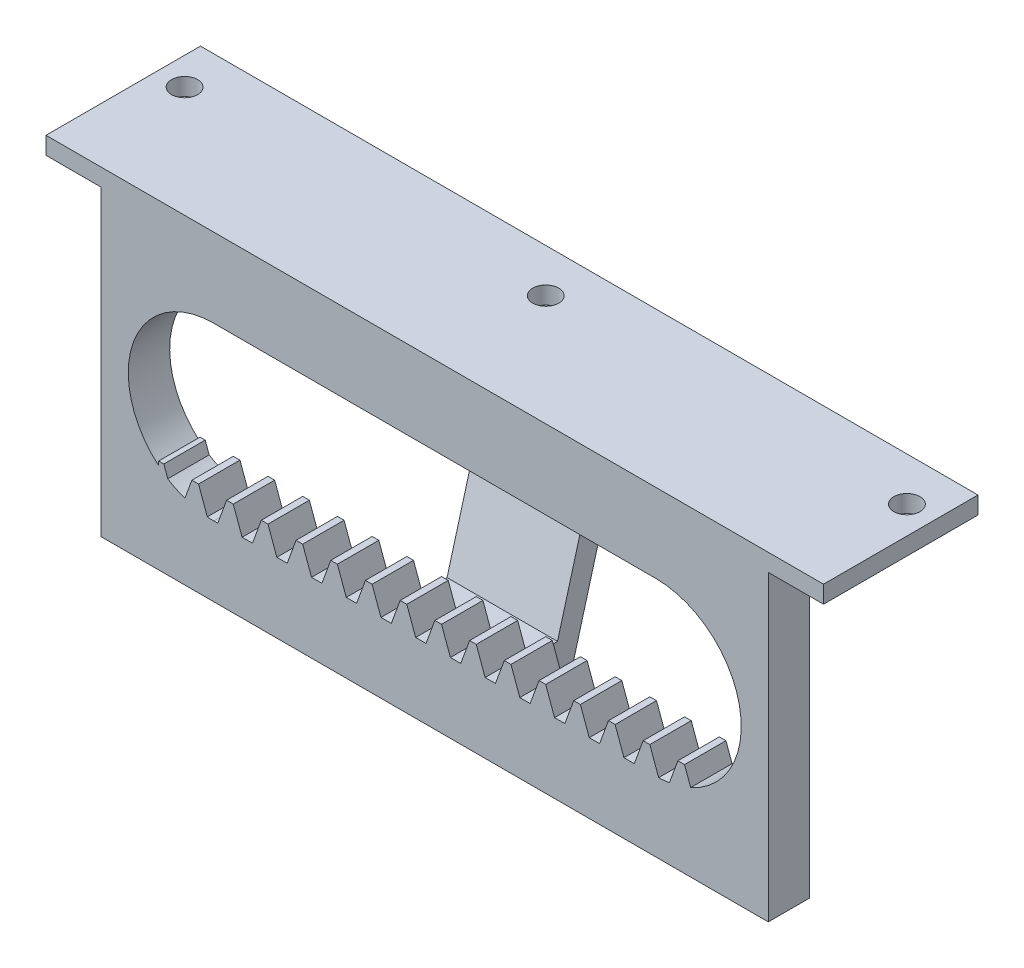
from build123d import *

# Parameters (mm, degrees)
SKETCH1_W           = 63.5
SKETCH1_H           = 4.7625
BOSS_EXTRUDE1_DEPTH = 4.5
CUT_EXTRUDE1_DEPTH  = 64.837147542
SKETCH4_W           = 76.708
SKETCH4_H           = 36.80996
BOSS_EXTRUDE2_DEPTH = 4.7625
SKETCH6_W           = 6.35
SKETCH6_H           = 17.76349
SKETCH6_R           = 1.5
BOSS_EXTRUDE3_DEPTH = 2
BOSS_EXTRUDE4_DEPTH = 25.4
BOSS_EXTRUDE5_DEPTH = 33.3375
SKETCH8_W           = 19.05
SKETCH8_H           = 13.00099
CUT_EXTRUDE2_DEPTH  = 86.863199382
SKETCH9_R           = 1.5
CUT_EXTRUDE3_DEPTH  = 86.863199382
FILLET1_R           = 2.54
SKETCH10_W          = 13.00099
SKETCH10_H          = 2
BOSS_EXTRUDE6_DEPTH = 5.0165
SKETCH11_W          = 13.00099
SKETCH11_H          = 2
BOSS_EXTRUDE7_DEPTH = 5.0165


with BuildPart() as part:
    # Sketch1 → Boss-Extrude1 (new body)
    with BuildSketch(Plane(origin=(0, 0, 0), x_dir=(1, 0, 0), z_dir=(0, 1, 0))):
        with Locations((31.75, 2.38125)):
            Rectangle(SKETCH1_W, SKETCH1_H)
    extrude(amount=BOSS_EXTRUDE1_DEPTH)

    # Sketch2 → Cut-Extrude1 (cut, through all)
    with BuildSketch(Plane.XY):
        Polygon((0.595167363, 4.5), (1.613024682, 1.70346), (2.208192045, 1.70346), (2.803359408, 1.70346), (3.821216727, 4.5), align=None)
        Polygon((4.586843593, 4.5), (5.604700912, 1.70346), (6.199868275, 1.70346), (6.795035638, 1.70346), (7.812892957, 4.5), align=None)
        Polygon((8.578519823, 4.5), (9.596377142, 1.70346), (10.191544505, 1.70346), (10.786711868, 1.70346), (11.804569186, 4.5), align=None)
        Polygon((12.570196052, 4.5), (13.588053371, 1.70346), (14.183220734, 1.70346), (14.778388097, 1.70346), (15.796245416, 4.5), align=None)
        Polygon((16.561872282, 4.5), (17.579729601, 1.70346), (18.174896964, 1.70346), (18.770064327, 1.70346), (19.787921646, 4.5), align=None)
        Polygon((20.553548512, 4.5), (21.571405831, 1.70346), (22.166573194, 1.70346), (22.761740557, 1.70346), (23.779597876, 4.5), align=None)
        Polygon((24.545224742, 4.5), (25.563082061, 1.70346), (26.158249424, 1.70346), (26.753416787, 1.70346), (27.771274106, 4.5), align=None)
        Polygon((28.536900972, 4.5), (29.554758291, 1.70346), (30.149925654, 1.70346), (30.745093017, 1.70346), (31.762950336, 4.5), align=None)
        Polygon((32.528577202, 4.5), (33.546434521, 1.70346), (34.141601884, 1.70346), (34.736769246, 1.70346), (35.754626565, 4.5), align=None)
        Polygon((36.520253431, 4.5), (37.53811075, 1.70346), (38.133278113, 1.70346), (38.728445476, 1.70346), (39.746302795, 4.5), align=None)
        Polygon((40.511929661, 4.5), (41.52978698, 1.70346), (42.124954343, 1.70346), (42.720121706, 1.70346), (43.737979025, 4.5), align=None)
        Polygon((44.503605891, 4.5), (45.52146321, 1.70346), (46.116630573, 1.70346), (46.711797936, 1.70346), (47.729655255, 4.5), align=None)
        Polygon((48.495282121, 4.5), (49.51313944, 1.70346), (50.108306803, 1.70346), (50.703474166, 1.70346), (51.721331485, 4.5), align=None)
        Polygon((52.486958351, 4.5), (53.50481567, 1.70346), (54.099983033, 1.70346), (54.695150396, 1.70346), (55.713007715, 4.5), align=None)
        Polygon((56.478634581, 4.5), (57.496491899, 1.70346), (58.091659262, 1.70346), (58.686826625, 1.70346), (59.704683944, 4.5), align=None)
        Polygon((60.47031081, 4.5), (61.488168129, 1.70346), (62.083335492, 1.70346), (62.678502855, 1.70346), (63.696360174, 4.5), align=None)
        Polygon((64.46198704, 4.5), (65.479844359, 1.70346), (66.075011722, 1.70346), (66.670179085, 1.70346), (67.688036404, 4.5), align=None)
        Polygon((68.45366327, 4.5), (69.471520589, 1.70346), (70.066687952, 1.70346), (70.661855315, 1.70346), (71.679712634, 4.5), align=None)
        Polygon((72.4453395, 4.5), (73.463196819, 1.70346), (74.058364182, 1.70346), (74.653531545, 1.70346), (75.671388864, 4.5), align=None)
        Polygon((76.43701573, 4.5), (77.454873049, 1.70346), (78.050040412, 1.70346), (78.645207775, 1.70346), (79.663065094, 4.5), align=None)
        Polygon((80.42869196, 4.5), (81.446549278, 1.70346), (82.041716641, 1.70346), (82.636884004, 1.70346), (83.654741323, 4.5), align=None)
        Polygon((84.420368189, 4.5), (85.438225508, 1.70346), (86.033392871, 1.70346), (86.628560234, 1.70346), (87.646417553, 4.5), align=None)
        Polygon((88.412044419, 4.5), (89.429901738, 1.70346), (90.025069101, 1.70346), (90.620236464, 1.70346), (91.638093783, 4.5), align=None)
        Polygon((92.403720649, 4.5), (93.421577968, 1.70346), (94.016745331, 1.70346), (94.611912694, 1.70346), (95.629770013, 4.5), align=None)
        Polygon((96.395396879, 4.5), (97.413254198, 1.70346), (98.008421561, 1.70346), (98.603588924, 1.70346), (99.621446243, 4.5), align=None)
        Polygon((100.387073109, 4.5), (101.404930428, 1.70346), (102.000097791, 1.70346), (102.595265154, 1.70346), (103.613122472, 4.5), align=None)
        Polygon((104.378749338, 4.5), (105.396606657, 1.70346), (105.99177402, 1.70346), (106.586941383, 1.70346), (107.604798702, 4.5), align=None)
        Polygon((108.370425568, 4.5), (109.388282887, 1.70346), (109.98345025, 1.70346), (110.578617613, 1.70346), (111.596474932, 4.5), align=None)
        Polygon((112.362101798, 4.5), (113.379959117, 1.70346), (113.97512648, 1.70346), (114.570293843, 1.70346), (115.588151162, 4.5), align=None)
        Polygon((116.353778028, 4.5), (117.371635347, 1.70346), (117.96680271, 1.70346), (118.561970073, 1.70346), (119.579827392, 4.5), align=None)
        Polygon((120.345454258, 4.5), (121.363311577, 1.70346), (121.95847894, 1.70346), (122.553646303, 1.70346), (123.571503622, 4.5), align=None)
        Polygon((124.337130488, 4.5), (125.354987807, 1.70346), (125.95015517, 1.70346), (126.545322532, 1.70346), (127.563179851, 4.5), align=None)
        Polygon((128.328806717, 4.5), (129.346664036, 1.70346), (129.941831399, 1.70346), (130.536998762, 1.70346), (131.554856081, 4.5), align=None)
        Polygon((132.320482947, 4.5), (133.338340266, 1.70346), (133.933507629, 1.70346), (134.528674992, 1.70346), (135.546532311, 4.5), align=None)
        Polygon((136.312159177, 4.5), (137.330016496, 1.70346), (137.925183859, 1.70346), (138.520351222, 1.70346), (139.538208541, 4.5), align=None)
        Polygon((140.303835407, 4.5), (141.321692726, 1.70346), (141.916860089, 1.70346), (142.512027452, 1.70346), (143.529884771, 4.5), align=None)
        Polygon((144.295511637, 4.5), (145.313368956, 1.70346), (145.908536319, 1.70346), (146.503703682, 1.70346), (147.521561001, 4.5), align=None)
        Polygon((148.287187867, 4.5), (149.305045185, 1.70346), (149.900212548, 1.70346), (150.495379911, 1.70346), (151.51323723, 4.5), align=None)
        Polygon((152.278864096, 4.5), (153.296721415, 1.70346), (153.891888778, 1.70346), (154.487056141, 1.70346), (155.50491346, 4.5), align=None)
        Polygon((156.270540326, 4.5), (157.288397645, 1.70346), (157.883565008, 1.70346), (158.478732371, 1.70346), (159.49658969, 4.5), align=None)
        Polygon((160.262216556, 4.5), (161.280073875, 1.70346), (161.875241238, 1.70346), (162.470408601, 1.70346), (163.48826592, 4.5), align=None)
        Polygon((164.253892786, 4.5), (165.271750105, 1.70346), (165.866917468, 1.70346), (166.462084831, 1.70346), (167.47994215, 4.5), align=None)
        Polygon((168.245569016, 4.5), (169.263426335, 1.70346), (169.858593698, 1.70346), (170.453761061, 1.70346), (171.47161838, 4.5), align=None)
        Polygon((172.237245246, 4.5), (173.255102564, 1.70346), (173.850269927, 1.70346), (174.44543729, 1.70346), (175.463294609, 4.5), align=None)
        Polygon((176.228921475, 4.5), (177.246778794, 1.70346), (177.841946157, 1.70346), (178.43711352, 1.70346), (179.454970839, 4.5), align=None)
        Polygon((180.220597705, 4.5), (181.238455024, 1.70346), (181.833622387, 1.70346), (182.42878975, 1.70346), (183.446647069, 4.5), align=None)
        Polygon((184.212273935, 4.5), (185.230131254, 1.70346), (185.825298617, 1.70346), (186.42046598, 1.70346), (187.438323299, 4.5), align=None)
        Polygon((188.203950165, 4.5), (189.221807484, 1.70346), (189.816974847, 1.70346), (190.41214221, 1.70346), (191.429999529, 4.5), align=None)
        Polygon((192.195626395, 4.5), (193.213483714, 1.70346), (193.808651077, 1.70346), (194.40381844, 1.70346), (195.421675758, 4.5), align=None)
        Polygon((196.187302624, 4.5), (197.205159943, 1.70346), (197.800327306, 1.70346), (198.395494669, 1.70346), (199.413351988, 4.5), align=None)
        Polygon((200.178978854, 4.5), (201.196836173, 1.70346), (201.792003536, 1.70346), (202.387170899, 1.70346), (203.405028218, 4.5), align=None)
        Polygon((204.170655084, 4.5), (205.188512403, 1.70346), (205.783679766, 1.70346), (206.378847129, 1.70346), (207.396704448, 4.5), align=None)
        Polygon((208.162331314, 4.5), (209.180188633, 1.70346), (209.775355996, 1.70346), (210.370523359, 1.70346), (211.388380678, 4.5), align=None)
        Polygon((212.154007544, 4.5), (213.171864863, 1.70346), (213.767032226, 1.70346), (214.362199589, 1.70346), (215.380056908, 4.5), align=None)
        Polygon((216.145683774, 4.5), (217.163541093, 1.70346), (217.758708456, 1.70346), (218.353875818, 1.70346), (219.371733137, 4.5), align=None)
        Polygon((220.137360003, 4.5), (221.155217322, 1.70346), (221.750384685, 1.70346), (222.345552048, 1.70346), (223.363409367, 4.5), align=None)
        Polygon((224.129036233, 4.5), (225.146893552, 1.70346), (225.742060915, 1.70346), (226.337228278, 1.70346), (227.355085597, 4.5), align=None)
        Polygon((228.120712463, 4.5), (229.138569782, 1.70346), (229.733737145, 1.70346), (230.328904508, 1.70346), (231.346761827, 4.5), align=None)
        Polygon((232.112388693, 4.5), (233.130246012, 1.70346), (233.725413375, 1.70346), (234.320580738, 1.70346), (235.338438057, 4.5), align=None)
        Polygon((236.104064923, 4.5), (237.121922242, 1.70346), (237.717089605, 1.70346), (238.312256968, 1.70346), (239.330114287, 4.5), align=None)
        Polygon((240.095741153, 4.5), (241.113598471, 1.70346), (241.708765834, 1.70346), (242.303933197, 1.70346), (243.321790516, 4.5), align=None)
        Polygon((244.087417382, 4.5), (245.105274701, 1.70346), (245.700442064, 1.70346), (246.295609427, 1.70346), (247.313466746, 4.5), align=None)
        Polygon((248.079093612, 4.5), (249.096950931, 1.70346), (249.692118294, 1.70346), (250.287285657, 1.70346), (251.305142976, 4.5), align=None)
        Polygon((252.070769842, 4.5), (253.088627161, 1.70346), (253.683794524, 1.70346), (254.278961887, 1.70346), (255.296819206, 4.5), align=None)
        Polygon((256.062446072, 4.5), (257.080303391, 1.70346), (257.675470754, 1.70346), (258.270638117, 1.70346), (259.288495436, 4.5), align=None)
        Polygon((260.054122302, 4.5), (261.071979621, 1.70346), (261.667146984, 1.70346), (262.262314347, 1.70346), (263.280171666, 4.5), align=None)
        Polygon((264.045798532, 4.5), (265.06365585, 1.70346), (265.658823213, 1.70346), (266.253990576, 1.70346), (267.271847895, 4.5), align=None)
        Polygon((268.037474761, 4.5), (269.05533208, 1.70346), (269.650499443, 1.70346), (270.245666806, 1.70346), (271.263524125, 4.5), align=None)
        Polygon((272.029150991, 4.5), (273.04700831, 1.70346), (273.642175673, 1.70346), (274.237343036, 1.70346), (275.255200355, 4.5), align=None)
        Polygon((276.020827221, 4.5), (277.03868454, 1.70346), (277.633851903, 1.70346), (278.229019266, 1.70346), (279.246876585, 4.5), align=None)
        Polygon((280.012503451, 4.5), (281.03036077, 1.70346), (281.625528133, 1.70346), (282.220695496, 1.70346), (283.238552815, 4.5), align=None)
        Polygon((284.004179681, 4.5), (285.022037, 1.70346), (285.617204363, 1.70346), (286.212371726, 1.70346), (287.230229044, 4.5), align=None)
        Polygon((287.99585591, 4.5), (289.013713229, 1.70346), (289.608880592, 1.70346), (290.204047955, 1.70346), (291.221905274, 4.5), align=None)
        Polygon((291.98753214, 4.5), (293.005389459, 1.70346), (293.600556822, 1.70346), (294.195724185, 1.70346), (295.213581504, 4.5), align=None)
        Polygon((295.97920837, 4.5), (296.997065689, 1.70346), (297.592233052, 1.70346), (298.187400415, 1.70346), (299.205257734, 4.5), align=None)
        Polygon((299.9708846, 4.5), (300.988741919, 1.70346), (301.583909282, 1.70346), (302.179076645, 1.70346), (303.196933964, 4.5), align=None)
        Polygon((303.96256083, 4.5), (304.980418149, 1.70346), (305.575585512, 1.70346), (306.170752875, 1.70346), (307.188610194, 4.5), align=None)
        Polygon((307.95423706, 4.5), (308.972094379, 1.70346), (309.567261742, 1.70346), (310.162429104, 1.70346), (311.180286423, 4.5), align=None)
        Polygon((311.945913289, 4.5), (312.963770608, 1.70346), (313.558937971, 1.70346), (314.154105334, 1.70346), (315.171962653, 4.5), align=None)
        Polygon((315.937589519, 4.5), (316.955446838, 1.70346), (317.550614201, 1.70346), (318.145781564, 1.70346), (319.163638883, 4.5), align=None)
        Polygon((319.929265749, 4.5), (320.947123068, 1.70346), (321.542290431, 1.70346), (322.137457794, 1.70346), (323.155315113, 4.5), align=None)
        Polygon((323.920941979, 4.5), (324.938799298, 1.70346), (325.533966661, 1.70346), (326.129134024, 1.70346), (327.146991343, 4.5), align=None)
        Polygon((327.912618209, 4.5), (328.930475528, 1.70346), (329.525642891, 1.70346), (330.120810254, 1.70346), (331.138667573, 4.5), align=None)
        Polygon((331.904294439, 4.5), (332.922151757, 1.70346), (333.51731912, 1.70346), (334.112486483, 1.70346), (335.130343802, 4.5), align=None)
        Polygon((335.895970668, 4.5), (336.913827987, 1.70346), (337.50899535, 1.70346), (338.104162713, 1.70346), (339.122020032, 4.5), align=None)
        Polygon((339.887646898, 4.5), (340.905504217, 1.70346), (341.50067158, 1.70346), (342.095838943, 1.70346), (343.113696262, 4.5), align=None)
        Polygon((343.879323128, 4.5), (344.897180447, 1.70346), (345.49234781, 1.70346), (346.087515173, 1.70346), (347.105372492, 4.5), align=None)
        Polygon((347.870999358, 4.5), (348.888856677, 1.70346), (349.48402404, 1.70346), (350.079191403, 1.70346), (351.097048722, 4.5), align=None)
        Polygon((351.862675588, 4.5), (352.880532907, 1.70346), (353.47570027, 1.70346), (354.070867633, 1.70346), (355.088724952, 4.5), align=None)
        Polygon((355.854351818, 4.5), (356.872209136, 1.70346), (357.467376499, 1.70346), (358.062543862, 1.70346), (359.080401181, 4.5), align=None)
        Polygon((359.846028047, 4.5), (360.863885366, 1.70346), (361.459052729, 1.70346), (362.054220092, 1.70346), (363.072077411, 4.5), align=None)
        Polygon((363.837704277, 4.5), (364.855561596, 1.70346), (365.450728959, 1.70346), (366.045896322, 1.70346), (367.063753641, 4.5), align=None)
        Polygon((367.829380507, 4.5), (368.847237826, 1.70346), (369.442405189, 1.70346), (370.037572552, 1.70346), (371.055429871, 4.5), align=None)
        Polygon((371.821056737, 4.5), (372.838914056, 1.70346), (373.434081419, 1.70346), (374.029248782, 1.70346), (375.047106101, 4.5), align=None)
        Polygon((375.812732967, 4.5), (376.830590286, 1.70346), (377.425757649, 1.70346), (378.020925012, 1.70346), (379.03878233, 4.5), align=None)
        Polygon((379.804409196, 4.5), (380.822266515, 1.70346), (381.417433878, 1.70346), (382.012601241, 1.70346), (383.03045856, 4.5), align=None)
        Polygon((383.796085426, 4.5), (384.813942745, 1.70346), (385.409110108, 1.70346), (386.004277471, 1.70346), (387.02213479, 4.5), align=None)
        Polygon((387.787761656, 4.5), (388.805618975, 1.70346), (389.400786338, 1.70346), (389.995953701, 1.70346), (391.01381102, 4.5), align=None)
        Polygon((391.779437886, 4.5), (392.797295205, 1.70346), (393.392462568, 1.70346), (393.987629931, 1.70346), (395.00548725, 4.5), align=None)
        Polygon((395.771114116, 4.5), (396.788971435, 1.70346), (397.384138798, 1.70346), (397.979306161, 1.70346), (398.99716348, 4.5), align=None)
        Polygon((399.762790346, 4.5), (400.780647665, 1.70346), (401.375815028, 1.70346), (401.97098239, 1.70346), (402.988839709, 4.5), align=None)
        Polygon((403.754466575, 4.5), (404.772323894, 1.70346), (405.367491257, 1.70346), (405.96265862, 1.70346), (406.980515939, 4.5), align=None)
        Polygon((407.746142805, 4.5), (408.764000124, 1.70346), (409.359167487, 1.70346), (409.95433485, 1.70346), (410.972192169, 4.5), align=None)
        Polygon((411.737819035, 4.5), (412.755676354, 1.70346), (413.350843717, 1.70346), (413.94601108, 1.70346), (414.963868399, 4.5), align=None)
        Polygon((415.729495265, 4.5), (416.747352584, 1.70346), (417.342519947, 1.70346), (417.93768731, 1.70346), (418.955544629, 4.5), align=None)
        Polygon((419.721171495, 4.5), (420.739028814, 1.70346), (421.334196177, 1.70346), (421.92936354, 1.70346), (422.947220859, 4.5), align=None)
        Polygon((423.712847725, 4.5), (424.730705043, 1.70346), (425.325872406, 1.70346), (425.921039769, 1.70346), (426.938897088, 4.5), align=None)
        Polygon((427.704523954, 4.5), (428.722381273, 1.70346), (429.317548636, 1.70346), (429.912715999, 1.70346), (430.930573318, 4.5), align=None)
        Polygon((431.696200184, 4.5), (432.714057503, 1.70346), (433.309224866, 1.70346), (433.904392229, 1.70346), (434.922249548, 4.5), align=None)
        Polygon((435.687876414, 4.5), (436.705733733, 1.70346), (437.300901096, 1.70346), (437.896068459, 1.70346), (438.913925778, 4.5), align=None)
        Polygon((439.679552644, 4.5), (440.697409963, 1.70346), (441.292577326, 1.70346), (441.887744689, 1.70346), (442.905602008, 4.5), align=None)
        Polygon((443.671228874, 4.5), (444.689086193, 1.70346), (445.284253556, 1.70346), (445.879420919, 1.70346), (446.897278238, 4.5), align=None)
        Polygon((447.662905104, 4.5), (448.680762422, 1.70346), (449.275929785, 1.70346), (449.871097148, 1.70346), (450.888954467, 4.5), align=None)
        Polygon((451.654581333, 4.5), (452.672438652, 1.70346), (453.267606015, 1.70346), (453.862773378, 1.70346), (454.880630697, 4.5), align=None)
        Polygon((455.646257563, 4.5), (456.664114882, 1.70346), (457.259282245, 1.70346), (457.854449608, 1.70346), (458.872306927, 4.5), align=None)
        Polygon((459.637933793, 4.5), (460.655791112, 1.70346), (461.250958475, 1.70346), (461.846125838, 1.70346), (462.863983157, 4.5), align=None)
        Polygon((463.629610023, 4.5), (464.647467342, 1.70346), (465.242634705, 1.70346), (465.837802068, 1.70346), (466.855659387, 4.5), align=None)
        Polygon((467.621286253, 4.5), (468.639143572, 1.70346), (469.234310935, 1.70346), (469.829478298, 1.70346), (470.847335616, 4.5), align=None)
        Polygon((471.612962482, 4.5), (472.630819801, 1.70346), (473.225987164, 1.70346), (473.821154527, 1.70346), (474.839011846, 4.5), align=None)
        Polygon((475.604638712, 4.5), (476.622496031, 1.70346), (477.217663394, 1.70346), (477.812830757, 1.70346), (478.830688076, 4.5), align=None)
        Polygon((479.596314942, 4.5), (480.614172261, 1.70346), (481.209339624, 1.70346), (481.804506987, 1.70346), (482.822364306, 4.5), align=None)
        Polygon((483.587991172, 4.5), (484.605848491, 1.70346), (485.201015854, 1.70346), (485.796183217, 1.70346), (486.814040536, 4.5), align=None)
        Polygon((487.579667402, 4.5), (488.597524721, 1.70346), (489.192692084, 1.70346), (489.787859447, 1.70346), (490.805716766, 4.5), align=None)
        Polygon((491.571343632, 4.5), (492.589200951, 1.70346), (493.184368314, 1.70346), (493.779535676, 1.70346), (494.797392995, 4.5), align=None)
        Polygon((495.563019861, 4.5), (496.58087718, 1.70346), (497.176044543, 1.70346), (497.771211906, 1.70346), (498.789069225, 4.5), align=None)
    extrude(amount=-CUT_EXTRUDE1_DEPTH, mode=Mode.SUBTRACT)

    # Sketch4 → Boss-Extrude2 (add)
    with BuildSketch(Plane.XY):
        with Locations((31.75, 12.05498)):
            Rectangle(SKETCH4_W, SKETCH4_H)
        with BuildLine():
            Line((57.15, 21.38846), (6.35, 21.38846))
            ThreePointArc((6.35, 21.38846), (-3.4925, 11.54596), (6.35, 1.70346))
            Line((6.35, 1.70346), (57.15, 1.70346))
            ThreePointArc((57.15, 1.70346), (66.9925, 11.54596), (57.15, 21.38846))
        make_face(mode=Mode.SUBTRACT)
    extrude(amount=-BOSS_EXTRUDE2_DEPTH)

    # Sketch6 → Boss-Extrude3 (add)
    # profile 1 of 2: a face of its own
    with BuildSketch(Plane(origin=(0, 30.45996, 0), x_dir=(1, 0, 0), z_dir=(0, 1, 0))):
        with Locations((73.279, 8.881745)):
            Rectangle(SKETCH6_W, SKETCH6_H)
        with Locations(Location((73.279, 12.7635, 0), (0, 0, 270))):
            Circle(SKETCH6_R, mode=Mode.SUBTRACT)
    # profile 2 of 2: a face of its own
    with BuildSketch(Plane(origin=(0, 30.45996, 0), x_dir=(1, 0, 0), z_dir=(0, 1, 0))):
        with Locations((-9.779, 8.881745)):
            Rectangle(SKETCH6_W, SKETCH6_H)
        with Locations(Location((-9.779, 12.7635, 0), (0, 0, 270))):
            Circle(SKETCH6_R, mode=Mode.SUBTRACT)
    extrude(amount=-BOSS_EXTRUDE3_DEPTH)

    # Sketch7 → Boss-Extrude4 (add, symmetric)
    with BuildSketch(Plane(origin=(31.75, 0, 0), x_dir=(0, 0, -1), z_dir=(1, 0, 0))):
        Polygon((4.7625, -6.35), (8.181031482, -6.35), (17.76349, 28.45996), (15.129008358, 28.45996), (7.7635, 1.70346), (4.7625, 1.70346), align=None)
    extrude(amount=BOSS_EXTRUDE4_DEPTH, both=True)

    # Sketch7<3> → Boss-Extrude5 (add, symmetric)
    with BuildSketch(Plane(origin=(31.75, 0, 0), x_dir=(0, 0, -1), z_dir=(1, 0, 0))):
        Polygon((17.76349, 28.45996), (15.129008358, 28.45996), (4.7625, 28.45996), (4.7625, 30.45996), (17.76349, 30.45996), align=None)
    extrude(amount=BOSS_EXTRUDE5_DEPTH, both=True)

    # Sketch8 → Cut-Extrude2 (cut, through all)
    with BuildSketch(Plane.XZ.offset(-28.45996)):
        with Locations((15.875, -11.262995)):
            Rectangle(SKETCH8_W, SKETCH8_H)
        with Locations((47.625, -11.262995)):
            Rectangle(SKETCH8_W, SKETCH8_H)
    extrude(amount=CUT_EXTRUDE2_DEPTH, mode=Mode.SUBTRACT)

    # Sketch9 → Cut-Extrude3 (cut, through all)
    with BuildSketch(Plane.XZ.offset(-28.45996)):
        with Locations(Location((31.75, -12.7635, 0), (0, 0, 270))):
            Circle(SKETCH9_R)
    extrude(amount=-CUT_EXTRUDE3_DEPTH, mode=Mode.SUBTRACT)

    # Fillet1
    fillet1_edges = [part.edges().sort_by_distance(p)[0] for p in [
        (25.4, 28.45996, -16.446249179),
        (38.1, 28.45996, -16.446249179),
    ]]
    fillet(fillet1_edges, radius=FILLET1_R)

    # Sketch10 → Boss-Extrude6 (add)
    with BuildSketch(Plane.ZY.offset(1.5875)):
        with Locations((-11.262995, 29.45996)):
            Rectangle(SKETCH10_W, SKETCH10_H)
    extrude(amount=BOSS_EXTRUDE6_DEPTH)

    # Sketch11 → Boss-Extrude7 (add)
    with BuildSketch(Plane(origin=(65.0875, 0, 0), x_dir=(0, 0, -1), z_dir=(1, 0, 0))):
        with Locations((11.262995, 29.45996)):
            Rectangle(SKETCH11_W, SKETCH11_H)
    extrude(amount=BOSS_EXTRUDE7_DEPTH)


solid = part.part
